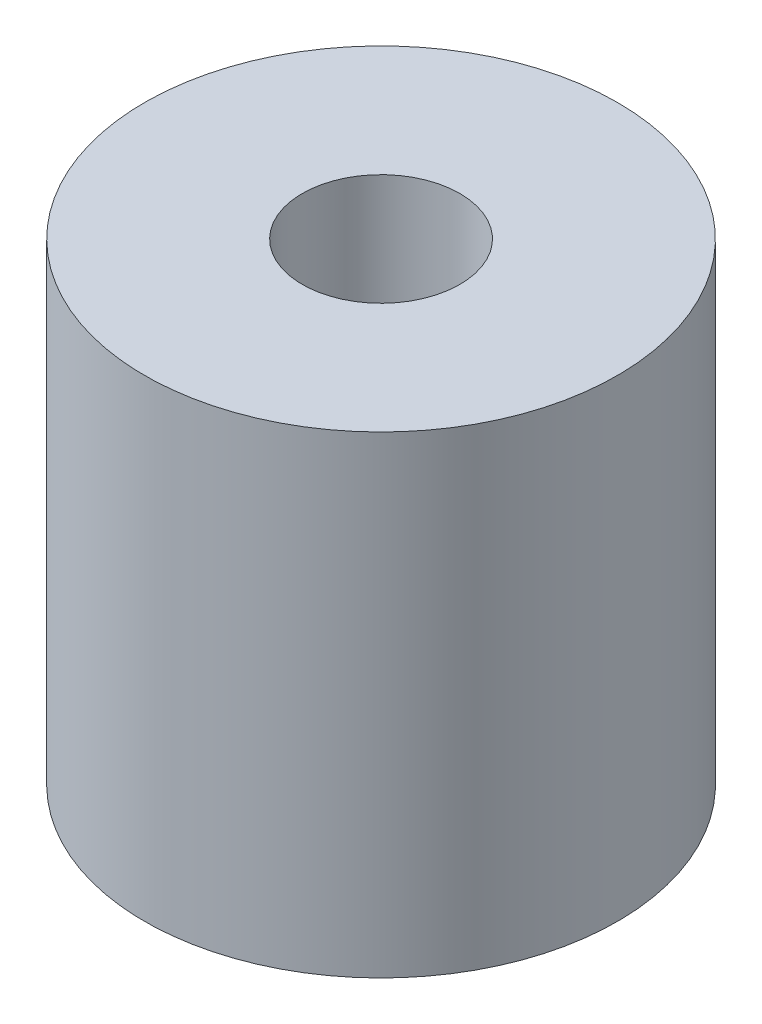
from build123d import *

# Parameters (mm, degrees)
SKETCH1_R           = 2.38125
SKETCH1_R_2         = 0.79375
BOSS_EXTRUDE1_DEPTH = 4.7625


with BuildPart() as part:
    # Sketch1 → Boss-Extrude1 (new body)
    with BuildSketch(Plane(origin=(0, 0, 0), x_dir=(1, 0, 0), z_dir=(0, 1, 0))):
        with Locations(Location((0, 0, 0), (0, 0, 90))):
            Circle(SKETCH1_R)
        with Locations(Location((0, 0, 0), (0, 0, 90))):
            Circle(SKETCH1_R_2, mode=Mode.SUBTRACT)
    extrude(amount=BOSS_EXTRUDE1_DEPTH)


solid = part.part
